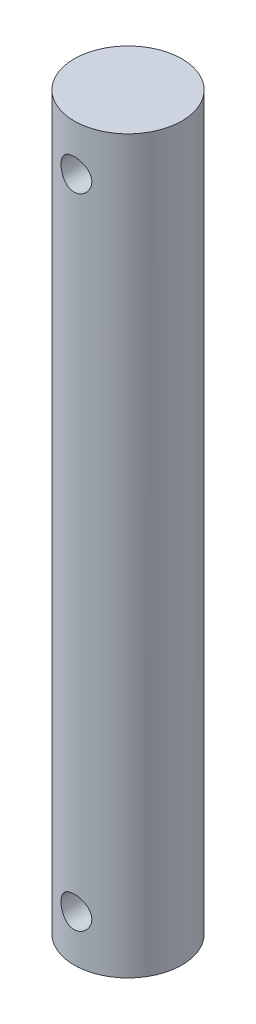
from build123d import *

# Parameters (mm, degrees)
SKETCH_1_R          = 3.5
EXTRUDE_1_DEPTH     = 54.5
SKETCH_2_R          = 1
CUT_EXTRUDE_2_DEPTH = 27.25
SKETCH_3_R          = 7.070877384
CUT_EXTRUDE_3_DEPTH = 3
SKETCH_4_R          = 6.045504862
CUT_EXTRUDE_4_DEPTH = 4


with BuildPart() as part:
    # Эскиз1 → Вытянуть1 (new body)
    with BuildSketch(Plane(origin=(0, 0, 0), x_dir=(1, 0, 0), z_dir=(0, 1, 0))):
        with Locations(Location((0, 0, 0), (0, 0, 270))):
            Circle(SKETCH_1_R)
    extrude(amount=EXTRUDE_1_DEPTH)

    # Эскиз2 → Вытянуть2 (cut, symmetric)
    with BuildSketch(Plane.XY):
        with Locations(Location((0, 48.5, 0), (0, 0, 89.99999997))):
            Circle(SKETCH_2_R)
        with Locations(Location((0, 7, 0), (0, 0, 89.99999997))):
            Circle(SKETCH_2_R)
    extrude(amount=CUT_EXTRUDE_2_DEPTH, both=True, mode=Mode.SUBTRACT)

    # Эскиз3 → Вытянуть3 (cut)
    with BuildSketch(Plane(origin=(0, 54.5, 0), x_dir=(1, 0, 0), z_dir=(0, 1, 0))):
        Circle(SKETCH_3_R)
    extrude(amount=-CUT_EXTRUDE_3_DEPTH, mode=Mode.SUBTRACT)

    # Эскиз4 → Вытянуть4 (cut)
    with BuildSketch(Plane.XZ):
        Circle(SKETCH_4_R)
    extrude(amount=-CUT_EXTRUDE_4_DEPTH, mode=Mode.SUBTRACT)


solid = part.part
